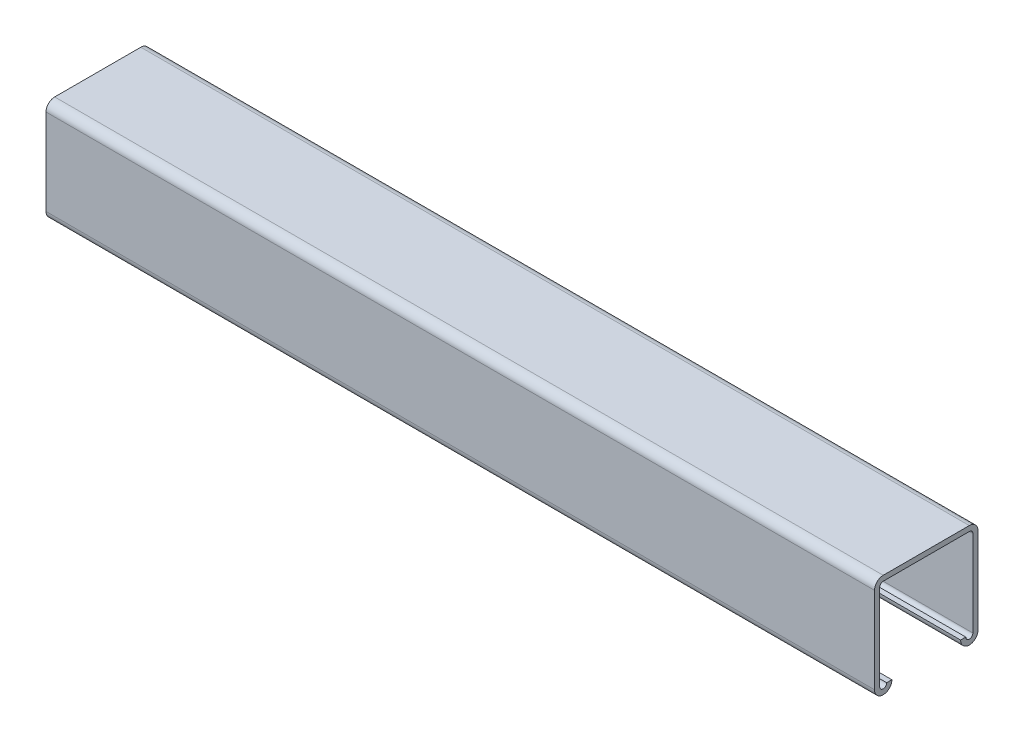
from build123d import *

# Parameters (mm, degrees)
CHANNEL_DEPTH = 305


with BuildPart() as part:
    # Sketch1 → Channel (new body)
    with BuildSketch(Plane(origin=(0, 39.243400922, 0), x_dir=(0, 0, 1), z_dir=(1, 0, 0))):
        with BuildLine():
            ThreePointArc((-12.65, 74.143400922), (-15.85, 77.343400922), (-19.05, 74.143400922))
            Line((-19.05, 74.143400922), (-19.05, 42.443400922))
            ThreePointArc((-19.05, 42.443400922), (-18.1127417, 40.180659222), (-15.85, 39.243400922))
            Line((-15.85, 39.243400922), (15.85, 39.243400922))
            ThreePointArc((15.85, 39.243400922), (18.1127417, 40.180659222), (19.05, 42.443400922))
            Line((19.05, 42.443400922), (19.05, 74.143400922))
            ThreePointArc((19.05, 74.143400922), (15.85, 77.343400922), (12.65, 74.143400922))
            Line((12.65, 74.143400922), (14.55, 74.143400922))
            ThreePointArc((14.55, 74.143400922), (15.85, 75.443400922), (17.15, 74.143400922))
            Line((17.15, 74.143400922), (17.15, 42.443400922))
            ThreePointArc((17.15, 42.443400922), (16.769238816, 41.524162106), (15.85, 41.143400922))
            Line((15.85, 41.143400922), (-15.85, 41.143400922))
            ThreePointArc((-15.85, 41.143400922), (-16.769238816, 41.524162106), (-17.15, 42.443400922))
            Line((-17.15, 42.443400922), (-17.15, 74.143400922))
            ThreePointArc((-17.15, 74.143400922), (-15.85, 75.443400922), (-14.55, 74.143400922))
            Line((-14.55, 74.143400922), (-12.65, 74.143400922))
        make_face()
    extrude(amount=CHANNEL_DEPTH)


solid = part.part
